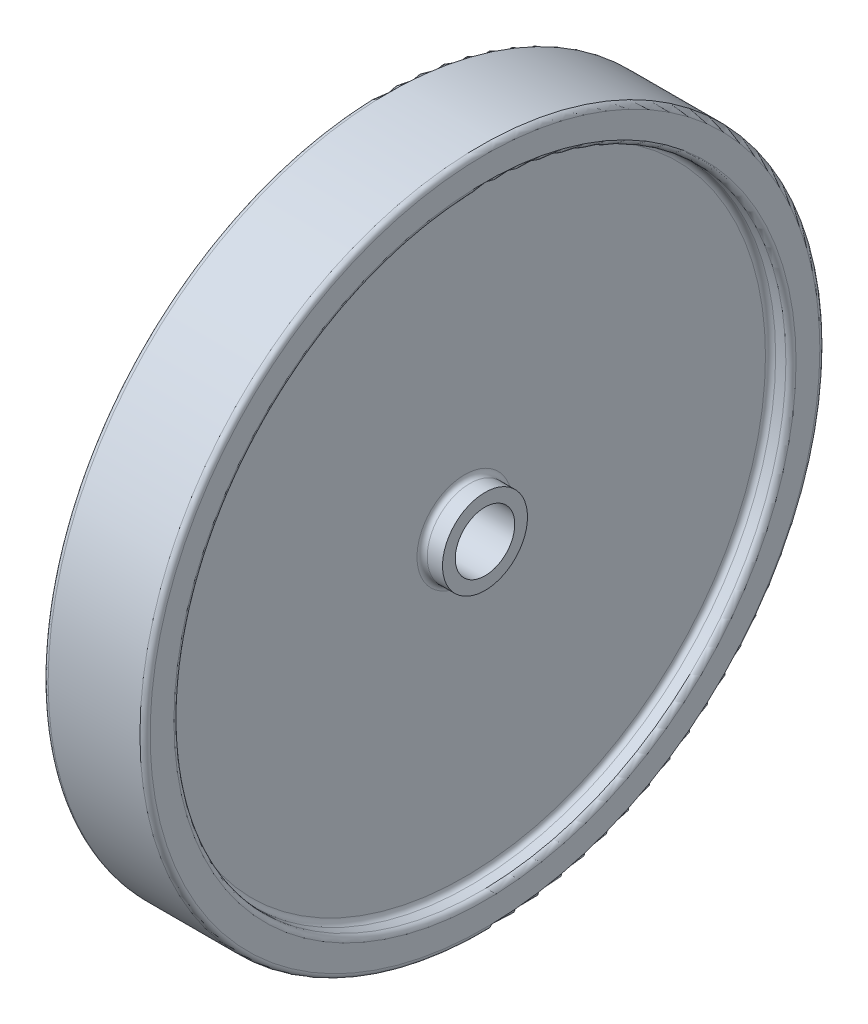
from build123d import *

# Parameters (mm, degrees)
SZKIC1_R                    = 200
SZKIC1_R_2                  = 17.5
DODANIE_WYCI_GNI_CIE1_DEPTH = 60
ZAOKR_GLENIE1_R             = 3
SZKIC2_R                    = 180
SZKIC2_R_2                  = 25
WYTNIJ_WYCI_GNI_CIE1_DEPTH  = 12
ZAOKR_GLENIE2_R             = 3
ZAOKR_GLENIE3_R             = 3


with BuildPart() as part:
    # Szkic1 → Dodanie-wyciągnięcie1 (new body)
    with BuildSketch(Plane(origin=(0, 0, 0), x_dir=(0, 0, -1), z_dir=(1, 0, 0))):
        Circle(SZKIC1_R)
        Circle(SZKIC1_R_2, mode=Mode.SUBTRACT)
    extrude(amount=DODANIE_WYCI_GNI_CIE1_DEPTH)

    # Zaokrąglenie1
    zaokr_glenie1_edges = [part.edges().sort_by_distance(p)[0] for p in [
        (0, 0, 200),
        (60, 0, 200),
    ]]
    fillet(zaokr_glenie1_edges, radius=ZAOKR_GLENIE1_R)

    # Szkic2 → Wytnij-wyciągnięcie1 (cut)
    with BuildSketch(Plane(origin=(60, 0, 0), x_dir=(0, 0, -1), z_dir=(1, 0, 0))):
        Circle(SZKIC2_R)
        Circle(SZKIC2_R_2, mode=Mode.SUBTRACT)
    wytnij_wyci_gni_cie1 = extrude(amount=-WYTNIJ_WYCI_GNI_CIE1_DEPTH, mode=Mode.SUBTRACT)

    # Zaokrąglenie2
    zaokr_glenie2_edges = [part.edges().sort_by_distance(p)[0] for p in [
        (48, 0, 180),
        (48, 0, 25),
        (60, 0, 180),
    ]]
    fillet(zaokr_glenie2_edges, radius=ZAOKR_GLENIE2_R)

    # Lustro1: Wytnij-wyciągnięcie1 across plane
    add(wytnij_wyci_gni_cie1.mirror(Plane(origin=(30, 0, 0), x_dir=(0, 0, 1), z_dir=(1, 0, 0))), mode=Mode.SUBTRACT)

    # Zaokrąglenie3
    zaokr_glenie3_edges = [part.edges().sort_by_distance(p)[0] for p in [
        (12, 0, 180),
        (0, 0, 180),
        (12, 0, 25),
    ]]
    fillet(zaokr_glenie3_edges, radius=ZAOKR_GLENIE3_R)


solid = part.part
